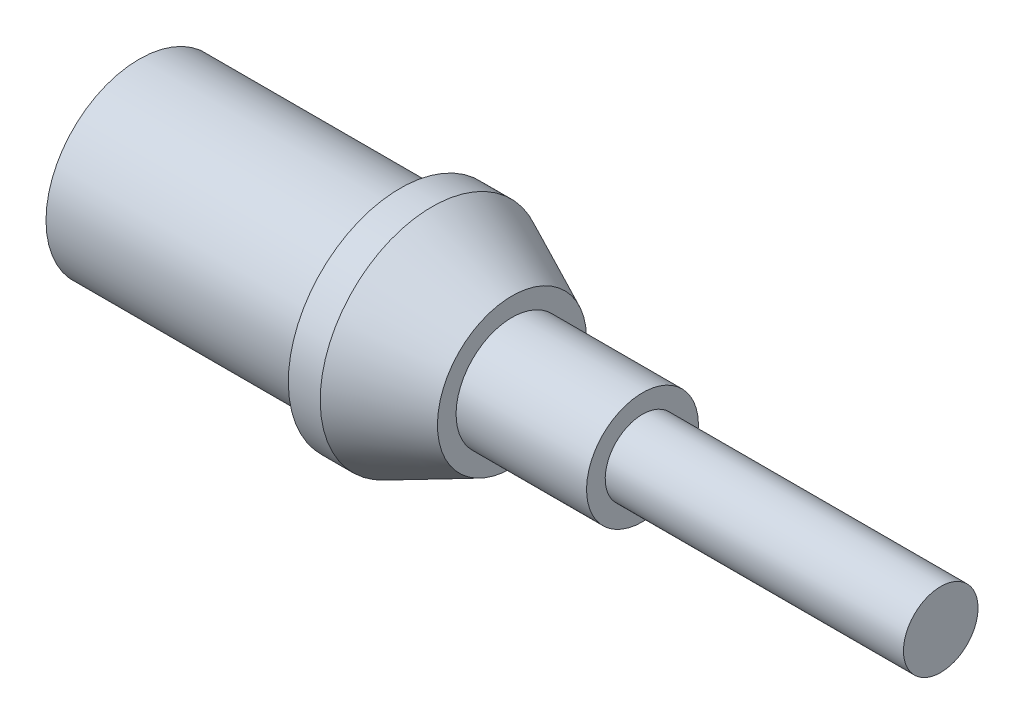
from build123d import *

# Parameters (mm, degrees)
CHANFREIN2_SIZE  = 1
CHANFREIN2_SIZE2 = 2.144506921


with BuildPart() as part:
    # Esquisse1 → Révolution16 (revolve)
    with BuildSketch(Plane.XY, mode=Mode.PRIVATE) as r_volution16_sk:
        Polygon((7, 3), (10, 3), (10, 1.5), (13.5, 1.5), (13.5, 1), (21.5, 1), (21.5, 0), (0, 0), (0, 2.5), (7, 2.5), align=None)
    revolve(r_volution16_sk.sketch.rotate(Axis((0, 0, 0), (1, 0, 0)), 180), axis=Axis((0, 0, 0), (1, 0, 0)))

    # Chanfrein2
    chanfrein2_edges = [part.edges().sort_by_distance(p)[0] for p in [
        (10, 3, 0),
    ]]
    chanfrein2_side = [part.faces().sort_by_distance(p)[0] for p in [
        (10, 2.915147186, 0),
    ]]
    chamfer(chanfrein2_edges, length=CHANFREIN2_SIZE, length2=CHANFREIN2_SIZE2, reference=chanfrein2_side[0])


solid = part.part
